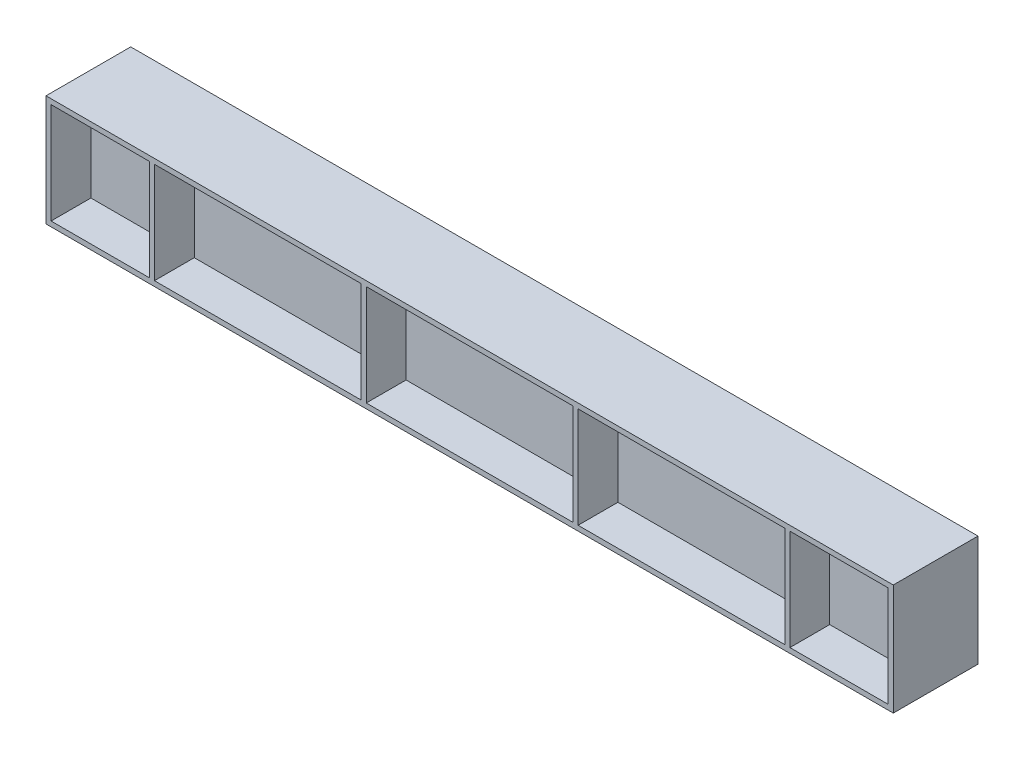
from build123d import *

# Parameters (mm, degrees)
SKETCH_1_W           = 2000
SKETCH_1_H           = 262
EXTRUDE_1_DEPTH      = 200
SKETCH_5_W           = 232
SKETCH_5_H           = 238
SKETCH_5_W_2         = 488
CUT_EXTRUDE_10_DEPTH = 2027.979032945
SKETCH_7_W           = 2000
SKETCH_7_H           = 12
EXTRUDE_13_DEPTH     = 260


with BuildPart() as part:
    # 草图1 → 拉伸1 (new body)
    with BuildSketch(Plane.XY):
        with Locations((1000, 131)):
            Rectangle(SKETCH_1_W, SKETCH_1_H)
    extrude(amount=EXTRUDE_1_DEPTH)

    # 草图5 → 拉伸10 (cut, through all)
    with BuildSketch(Plane.XY.offset(200)):
        with Locations((128, 131)):
            Rectangle(SKETCH_5_W, SKETCH_5_H)
        with Locations((500, 131)):
            Rectangle(SKETCH_5_W_2, SKETCH_5_H)
        with Locations((1000, 131)):
            Rectangle(SKETCH_5_W_2, SKETCH_5_H)
        with Locations((1500, 131)):
            Rectangle(SKETCH_5_W_2, SKETCH_5_H)
        with Locations((1872, 131)):
            Rectangle(SKETCH_5_W, SKETCH_5_H)
    extrude(amount=-CUT_EXTRUDE_10_DEPTH, mode=Mode.SUBTRACT)

    # 草图7 → 拉伸13 (add)
    with BuildSketch(Plane.XZ):
        with Locations((1000, 100)):
            Rectangle(SKETCH_7_W, SKETCH_7_H)
    extrude(amount=-EXTRUDE_13_DEPTH)


solid = part.part
